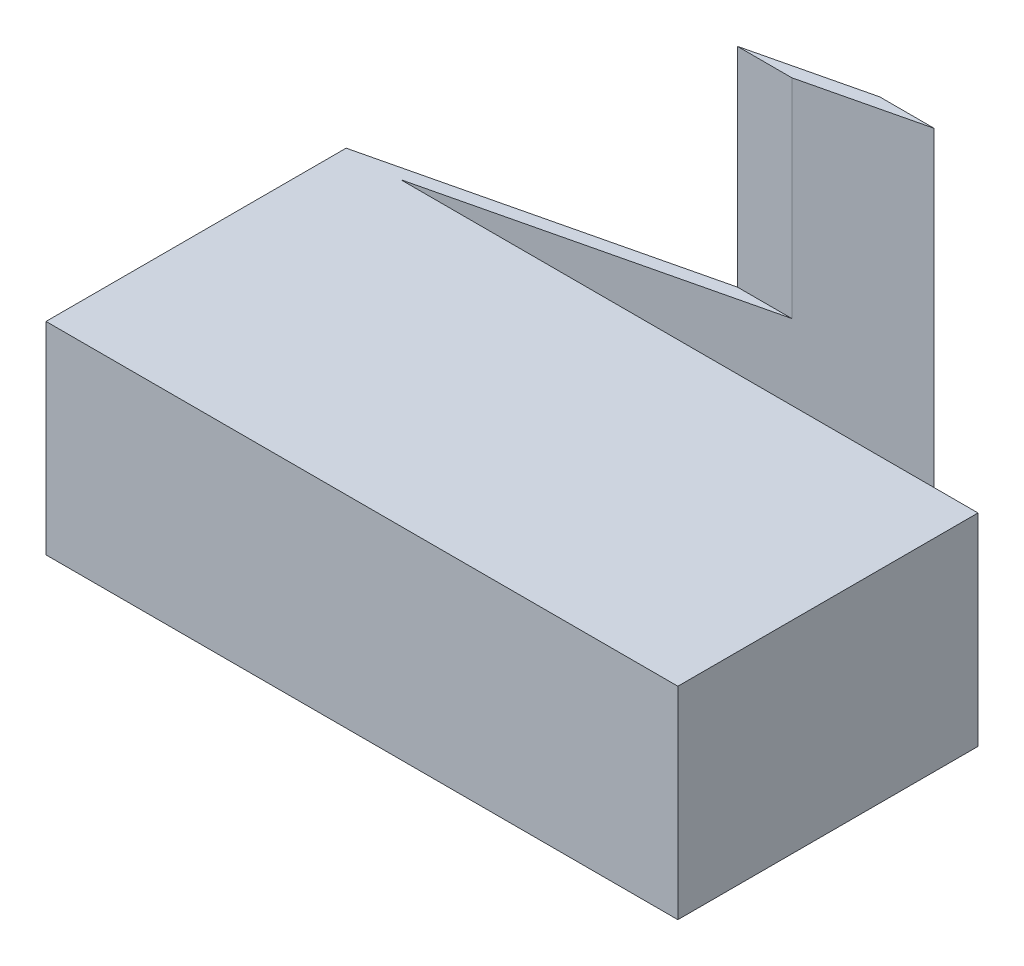
from build123d import *

# Parameters (mm, degrees)
AUFSATZ_LINEAR_AUSTRAGEN1_DEPTH = 6.4
AUFSATZ_LINEAR_AUSTRAGEN2_DEPTH = 13


with BuildPart() as part:
    # Skizze1 → Aufsatz-Linear austragen1 (new body)
    with BuildSketch(Plane(origin=(0, 0, 0), x_dir=(1, 0, 0), z_dir=(0, 1, 0))):
        Polygon((-10, 4.75), (-10, -4.75), (10, -4.75), (10, 4.75), (-8.27456026, 4.75), (5.36271987, 8), (3.63728013, 8), align=None)
    extrude(amount=AUFSATZ_LINEAR_AUSTRAGEN1_DEPTH)

    # Skizze1<3> → Aufsatz-Linear austragen2 (add)
    with BuildSketch(Plane(origin=(0, 0, 0), x_dir=(1, 0, 0), z_dir=(0, 1, 0))):
        Polygon((3.63728013, 8), (0, 7.133173161), (1.72543974, 7.133173161), (5.36271987, 8), align=None)
    extrude(amount=AUFSATZ_LINEAR_AUSTRAGEN2_DEPTH)


solid = part.part
